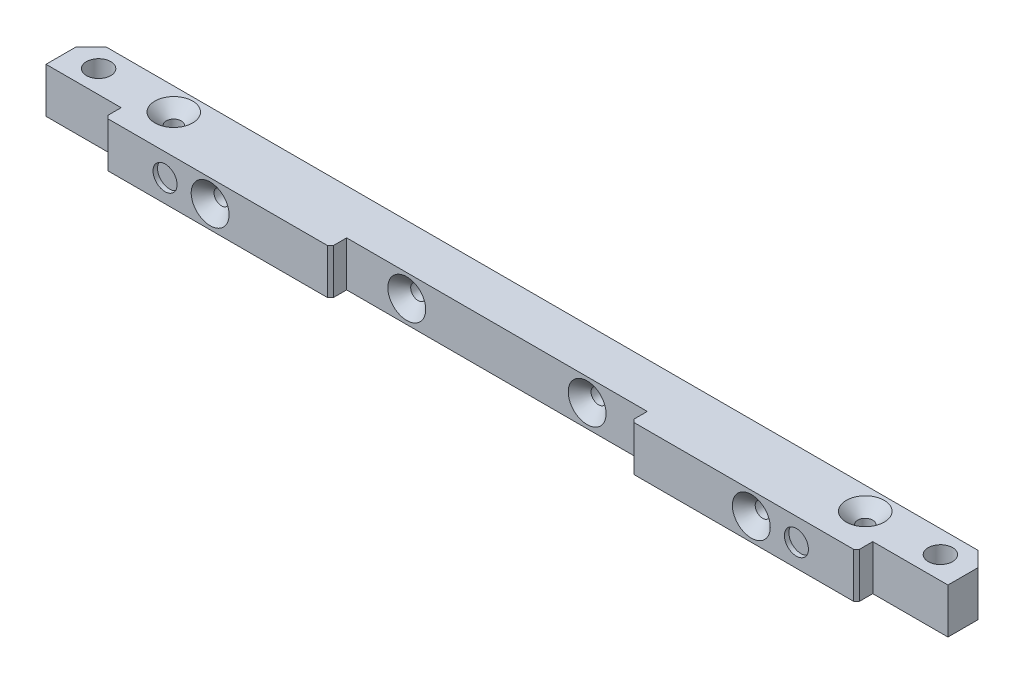
from build123d import *

# Parameters (mm, degrees)
SKETCH_1_W                   = 300
SKETCH_1_H                   = 15
EXTRUDE_328_DEPTH            = 15
HOLE_WIZARD_M6_D             = 5
HOLE_WIZARD_M6_CSINK_D       = 12.6
HOLE_WIZARD_M6_CSINK_ANGLE   = 90
HOLE_WIZARD_8_1_D            = 8.1
SKETCH_8_W                   = 250
SKETCH_8_H                   = 15
EXTRUDE_2374_DEPTH           = 5.4
SKETCH_9_R                   = 4
CUT_EXTRUDE_2694_DEPTH       = 1.5
SKETCH_10_W                  = 100
SKETCH_10_H                  = 15
CUT_EXTRUDE_2982_DEPTH       = 5.4
HOLE_WIZARD_1_M6_D           = 5
HOLE_WIZARD_1_M6_CSINK_D     = 12.6
HOLE_WIZARD_1_M6_CSINK_ANGLE = 90
HOLE_WIZARD_2_M6_D           = 5
HOLE_WIZARD_2_M6_CSINK_D     = 12.6
HOLE_WIZARD_2_M6_CSINK_ANGLE = 90
CHAMFER_1_SIZE               = 5
CHAMFER_2_SIZE               = 1


with BuildPart() as part:
    # Эскиз1 → Extrude 328 (new body)
    with BuildSketch(Plane(origin=(0, 0, 0), x_dir=(1, 0, 0), z_dir=(0, 1, 0))):
        Rectangle(SKETCH_1_W, SKETCH_1_H)
    extrude(amount=EXTRUDE_328_DEPTH)

    # Крепление шарнира M6 (through all)
    with Locations(Plane(origin=(0, 15, 0), x_dir=(1, 0, 0), z_dir=(0, 1, 0))):
        with Locations((-115, 0), (115, 0)):
            CounterSinkHole(HOLE_WIZARD_M6_D / 2, HOLE_WIZARD_M6_CSINK_D / 2, counter_sink_angle=HOLE_WIZARD_M6_CSINK_ANGLE)

    # Отверстие-8.1мм (through all)
    with Locations(Plane(origin=(0, 15, 0), x_dir=(1, 0, 0), z_dir=(0, 1, 0))):
        with Locations((-140, 0), (140, 0)):
            Hole(HOLE_WIZARD_8_1_D / 2)

    # Эскиз8 → Extrude 2374 (add)
    with BuildSketch(Plane.XY.offset(7.5)):
        with Locations((0, 7.5)):
            Rectangle(SKETCH_8_W, SKETCH_8_H)
    extrude(amount=EXTRUDE_2374_DEPTH)

    # Эскиз9 → Cut-Extrude 2694 (cut)
    with BuildSketch(Plane.XY.offset(12.9)):
        with Locations((-105, 7.5)):
            Circle(SKETCH_9_R)
        with Locations((105, 7.5)):
            Circle(SKETCH_9_R)
    extrude(amount=-CUT_EXTRUDE_2694_DEPTH, mode=Mode.SUBTRACT)

    # Эскиз10 → Cut-Extrude 2982 (cut)
    with BuildSketch(Plane.XY.offset(12.9)):
        with Locations((0, 7.5)):
            Rectangle(SKETCH_10_W, SKETCH_10_H)
    extrude(amount=-CUT_EXTRUDE_2982_DEPTH, mode=Mode.SUBTRACT)

    # Прижим-1-M6 (through all)
    with Locations(Plane.XY.offset(12.9)):
        with Locations((-90, 7.5), (90, 7.5)):
            CounterSinkHole(HOLE_WIZARD_1_M6_D / 2, HOLE_WIZARD_1_M6_CSINK_D / 2, counter_sink_angle=HOLE_WIZARD_1_M6_CSINK_ANGLE)

    # Прижим-2-M6 (through all)
    with Locations(Plane.XY.offset(7.5)):
        with Locations((-30, 7.5), (30, 7.5)):
            CounterSinkHole(HOLE_WIZARD_2_M6_D / 2, HOLE_WIZARD_2_M6_CSINK_D / 2, counter_sink_angle=HOLE_WIZARD_2_M6_CSINK_ANGLE)

    # Фаска1
    chamfer_1_edges = [part.edges().sort_by_distance(p)[0] for p in [
        (-150, 7.5, -7.5),
        (150, 7.5, -7.5),
    ]]
    chamfer(chamfer_1_edges, length=CHAMFER_1_SIZE)

    # Фаска2
    chamfer_2_edges = [part.edges().sort_by_distance(p)[0] for p in [
        (-125, 7.5, 12.9),
        (125, 7.5, 12.9),
        (-50, 7.5, 12.9),
        (50, 7.5, 12.9),
    ]]
    chamfer(chamfer_2_edges, length=CHAMFER_2_SIZE)


solid = part.part
